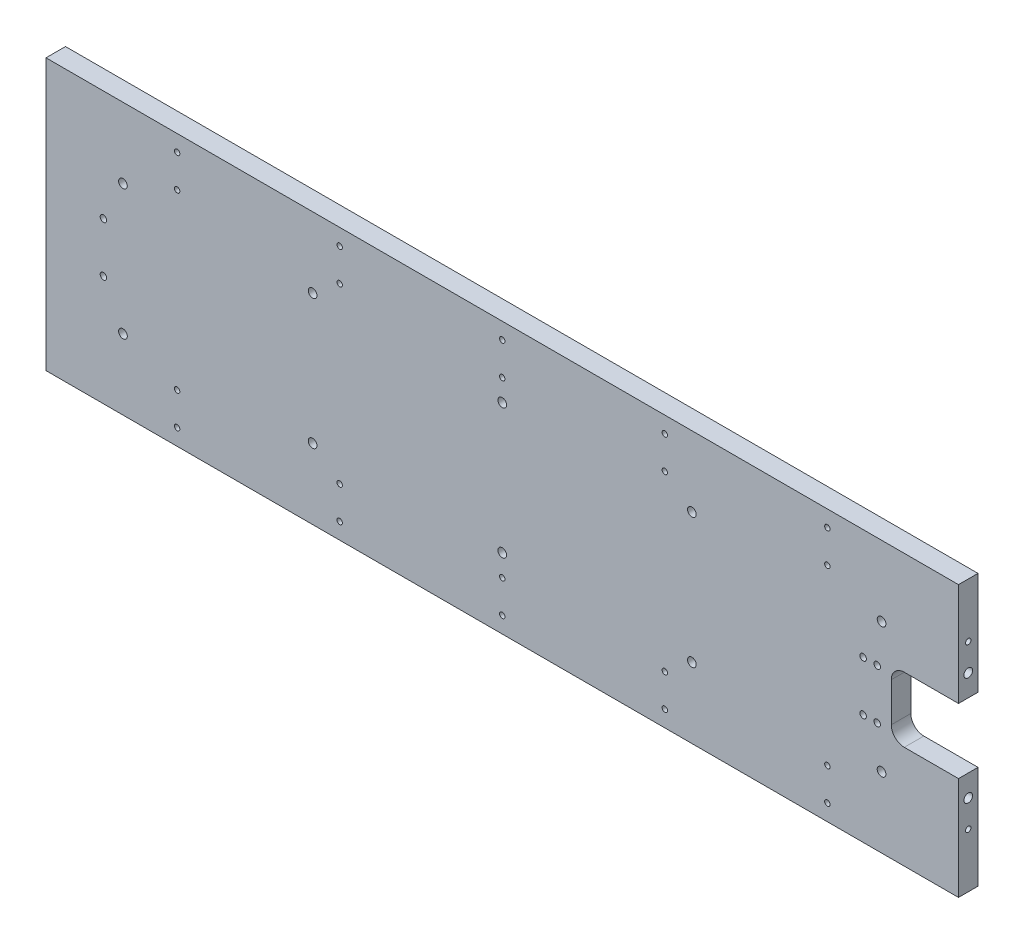
from build123d import *

# Parameters (mm, degrees)
SKETCH1_W                           = 842
SKETCH1_H                           = 250
BOSS_EXTRUDE1_DEPTH                 = 18
OTWORY_USTALAJ_CE_5_0MM1_D          = 5
OTWORY_USTALAJ_CE_6_0MM1_D          = 6
OTWORY_USTALAJ_CE_8_0MM1_D          = 8
OTWORY_USTALAJ_CE_5_0MM2_AT_2_COUNT = 2
OTWORY_USTALAJ_CE_5_0MM2_AT_2_PITCH = 150
WYTNIJ_WYCI_GNI_CIE1_DEPTH          = 440.533843976
OTW_R_8_0_8_1_AT_2_COUNT            = 2
OTW_R_8_0_8_1_AT_2_PITCH            = 100


with BuildPart() as part:
    # Sketch1 → Boss-Extrude1 (new body)
    with BuildSketch(Plane.XY):
        Rectangle(SKETCH1_W, SKETCH1_H)
    extrude(amount=BOSS_EXTRUDE1_DEPTH)

    # Otwory ustalające Ø5.0mm1 (through all)
    with Locations(Plane.XY.offset(18)):
        with Locations((-300, 110), (-300, 80), (-150, 110), (-150, 80), (0, 110), (0, 80), (150, 110), (150, 80), (300, 110), (300, 80), (-300, -80), (-300, -110), (-150, -80), (-150, -110), (0, -80), (0, -110), (150, -80), (150, -110), (300, -80), (300, -110)):
            Hole(OTWORY_USTALAJ_CE_5_0MM1_D / 2)

    # Otwory ustalające Ø6.0mm1 (through all)
    with Locations(Plane.XY.offset(18)):
        with Locations((-368, 23), (-368, -23), (333, 23), (346, 23), (333, -23), (346, -23)):
            Hole(OTWORY_USTALAJ_CE_6_0MM1_D / 2)

    # Otwory ustalające Ø8.0mm1 (through all)
    with Locations(Plane.XY.offset(18)):
        with Locations((-350, 60), (-175, 60), (0, 60), (175, 60), (350, 60), (350, -60), (175, -60), (0, -60), (-175, -60), (-350, -60)):
            Hole(OTWORY_USTALAJ_CE_8_0MM1_D / 2)

    # Szkic9 → Otwory ustalające Ø5.0mm2 (revolve, cut)
    with BuildSketch(Plane(origin=(421, 75, 9), x_dir=(0, 0, -1), z_dir=(0, 1, 0))):
        Polygon((0, 0), (0, 46.502151548), (2.5, 45), (2.5, 0), align=None)
    otwory_ustalaj_ce_5_0mm2 = revolve(axis=Axis((427.35, 75, 9), (-1, 0, 0)), mode=Mode.SUBTRACT)

    # Otwory ustalające Ø5.0mm2 at 2: Otwory ustalające Ø5.0mm2 ×2
    with Locations(*[(0, -i * OTWORY_USTALAJ_CE_5_0MM2_AT_2_PITCH, 0) for i in range(1, OTWORY_USTALAJ_CE_5_0MM2_AT_2_COUNT)]):
        add(otwory_ustalaj_ce_5_0mm2, mode=Mode.SUBTRACT)

    # Lustro1: Otwory ustalające Ø5.0mm2 across plane
    add(otwory_ustalaj_ce_5_0mm2.mirror(Plane.ZY), mode=Mode.SUBTRACT)

    # Lustro1 copy 1 sketch → Lustro1 copy 1 (revolve, cut)
    with BuildSketch(Plane(origin=(-421, -75, 9), x_dir=(0, 0, -1), z_dir=(0, 1, 0))):
        Polygon((0, 0), (0, -46.502151548), (2.5, -45), (2.5, 0), align=None)
    revolve(axis=Axis((-427.35, -75, 9), (-1, 0, 0)), mode=Mode.SUBTRACT)

    # Szkic10 → Wytnij-wyciągnięcie1 (cut, through all)
    with BuildSketch(Plane.XY.offset(18)):
        with BuildLine():
            Line((421, 30), (371, 30))
            ThreePointArc((371, 30), (362.514718626, 26.485281374), (359, 18))
            Line((359, 18), (359, -18))
            ThreePointArc((359, -18), (362.514718626, -26.485281374), (371, -30))
            Line((371, -30), (421, -30))
            Line((421, -30), (421, 30))
        make_face()
    extrude(amount=-WYTNIJ_WYCI_GNI_CIE1_DEPTH, mode=Mode.SUBTRACT)

    # Szkic11 → Otwór Ø8.0 (8)1 (revolve, cut)
    with BuildSketch(Plane(origin=(-421, 50, 9), x_dir=(0, 0, 1), z_dir=(0, 1, 0))):
        Polygon((0, 0), (0, 24.403442476), (4, 22), (4, 0), align=None)
    otw_r_8_0_8_1 = revolve(axis=Axis((-427.35, 50, 9), (1, 0, 0)), mode=Mode.SUBTRACT)

    # Otwór Ø8.0 (8)1 at 2: Otwór Ø8.0 (8)1 ×2
    with Locations(*[(0, -i * OTW_R_8_0_8_1_AT_2_PITCH, 0) for i in range(1, OTW_R_8_0_8_1_AT_2_COUNT)]):
        add(otw_r_8_0_8_1, mode=Mode.SUBTRACT)

    # Lustro2: Otwór Ø8.0 (8)1 across plane
    add(otw_r_8_0_8_1.mirror(Plane.ZY), mode=Mode.SUBTRACT)

    # Lustro2 copy 1 sketch → Lustro2 copy 1 (revolve, cut)
    with BuildSketch(Plane(origin=(421, -50, 9), x_dir=(0, 0, 1), z_dir=(0, 1, 0))):
        Polygon((0, 0), (0, -24.403442476), (4, -22), (4, 0), align=None)
    revolve(axis=Axis((427.35, -50, 9), (1, 0, 0)), mode=Mode.SUBTRACT)


solid = part.part
